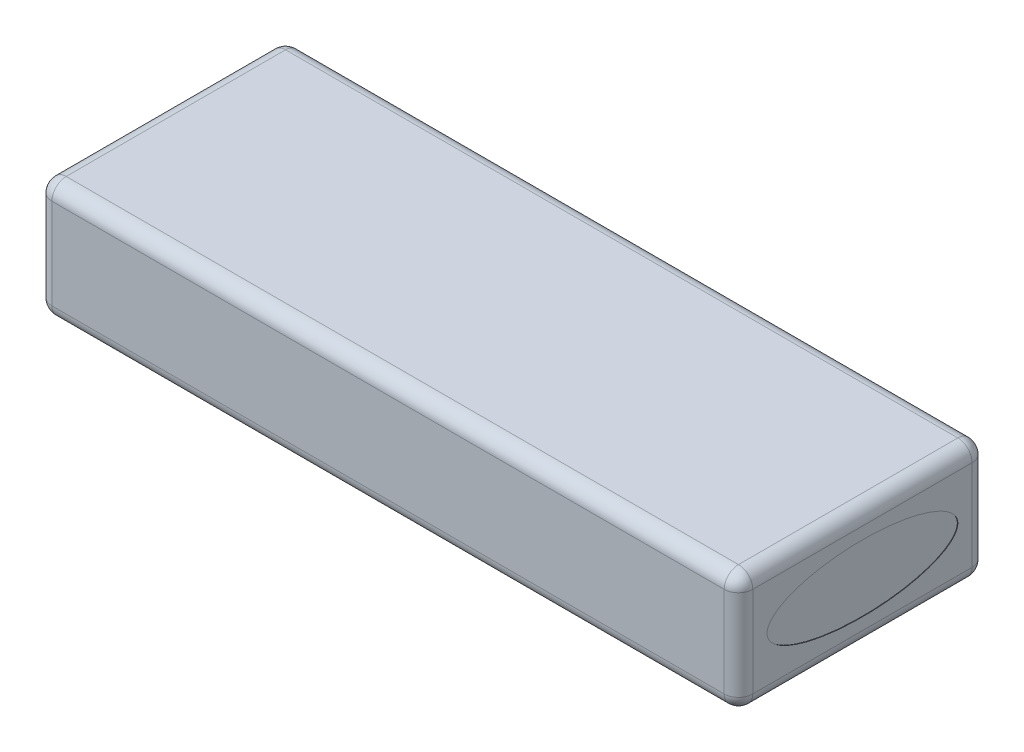
from build123d import *

# Parameters (mm, degrees)
RESSALTO_EXTRUS_O1_DEPTH      = 12.5
RESSALTO_EXTRUS_O1_DEPTH_BACK = 12.5
ESBO_O1_W                     = 147
ESBO_O1_H                     = 52
FILETE1_R                     = 3
FILETE2_R                     = 3
ESBO_O2_RX                    = 20
ESBO_O2_RY                    = 7
CORTE_EXTRUS_O1_DEPTH         = 0.1
ESBO_O3_RX                    = 20
ESBO_O3_RY                    = 7
CORTE_EXTRUS_O2_DEPTH         = 0.1


with BuildPart() as part:
    # Esboço1 → Ressalto-extrusão1 (new, two sides: drawn at the far end of the back side and taken through both)
    with BuildSketch(Plane(origin=(0, 0, 0), x_dir=(1, 0, 0), z_dir=(0, 1, 0)).offset(-RESSALTO_EXTRUS_O1_DEPTH_BACK)):
        Rectangle(ESBO_O1_W, ESBO_O1_H)
    extrude(amount=RESSALTO_EXTRUS_O1_DEPTH + RESSALTO_EXTRUS_O1_DEPTH_BACK)

    # Filete1
    filete1_edges = [part.edges().sort_by_distance(p)[0] for p in [
        (0, -12.5, 26),
        (0, -12.5, -26),
        (0, 12.5, -26),
        (0, 12.5, 26),
    ]]
    fillet(filete1_edges, radius=FILETE1_R)

    # Filete2
    filete2_edges = [part.edges().sort_by_distance(p)[0] for p in [
        (-73.5, -11.621320344, -25.121320344),
        (-73.5, 0, -26),
        (-73.5, 11.621320344, -25.121320344),
        (-73.5, 12.5, 0),
        (-73.5, 11.621320344, 25.121320344),
        (-73.5, 0, 26),
        (-73.5, -11.621320344, 25.121320344),
        (-73.5, -12.5, 0),
        (73.5, -11.621320344, -25.121320344),
        (73.5, 11.621320344, -25.121320344),
        (73.5, 11.621320344, 25.121320344),
        (73.5, -11.621320344, 25.121320344),
        (73.5, 0, 26),
        (73.5, 12.5, 0),
        (73.5, 0, -26),
        (73.5, -12.5, 0),
    ]]
    fillet(filete2_edges, radius=FILETE2_R)

    # Esboço2 → Corte-extrusão1 (cut)
    with BuildSketch(Plane(origin=(73.5, 0, 0), x_dir=(0, 0, -1), z_dir=(1, 0, 0))):
        with Locations((0, 0)):
            Ellipse(ESBO_O2_RX, ESBO_O2_RY)
    extrude(amount=-CORTE_EXTRUS_O1_DEPTH, mode=Mode.SUBTRACT)

    # Esboço3 → Corte-extrusão2 (cut)
    with BuildSketch(Plane.ZY.offset(73.5)):
        with Locations(Location((0, 0), (0, 0, 180))):
            Ellipse(ESBO_O3_RX, ESBO_O3_RY)
    extrude(amount=-CORTE_EXTRUS_O2_DEPTH, mode=Mode.SUBTRACT)


solid = part.part
